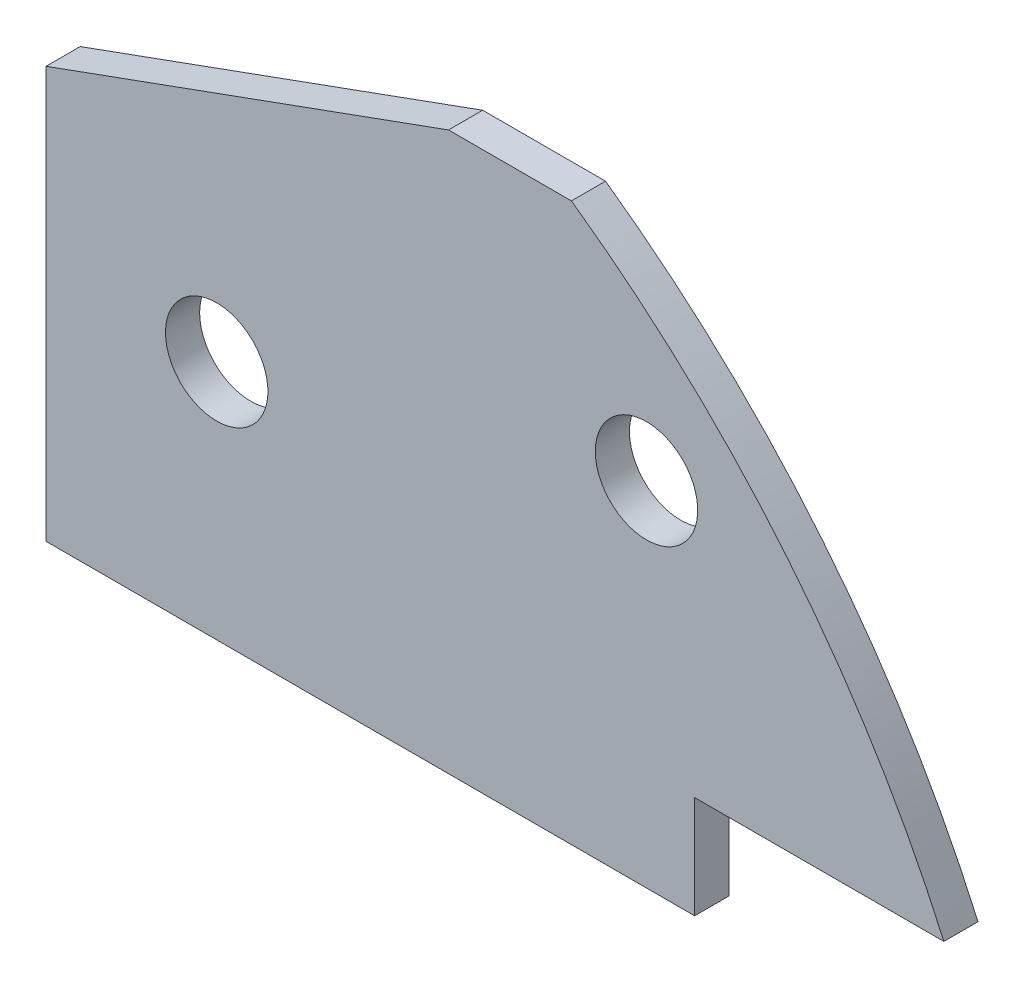
from build123d import *

# Parameters (mm, degrees)
BOSS_EXTRUDE1_DEPTH = 3
SKETCH2_R           = 1.5
CUT_EXTRUDE3_DEPTH  = 3
CUT_EXTRUDE4_START  = -10
CUT_EXTRUDE4_DEPTH  = 10
BOSS_EXTRUDE2_START = -3
BOSS_EXTRUDE2_DEPTH = 3
SKETCH5_W           = 0.56
SKETCH5_H           = 32.898596714
CUT_EXTRUDE5_DEPTH  = 3
SKETCH6_W           = 0.2
SKETCH6_H           = 32.898596714
CUT_EXTRUDE6_DEPTH  = 3
SKETCH7_R           = 2
CUT_EXTRUDE8_DEPTH  = 3
BOSS_EXTRUDE3_START = -3
BOSS_EXTRUDE3_DEPTH = 3
CUT_EXTRUDE9_START  = -3
CUT_EXTRUDE9_DEPTH  = 3
BOSS_EXTRUDE5_START = -3
BOSS_EXTRUDE5_DEPTH = 3
CUT_EXTRUDE10_START = -2
CUT_EXTRUDE10_DEPTH = 2
CUT_EXTRUDE11_START = -3
CUT_EXTRUDE11_DEPTH = 3
SKETCH13_R          = 1.5
CUT_EXTRUDE12_DEPTH = 1
CUT_EXTRUDE13_DEPTH = 10
SKETCH15_R          = 1.5
CUT_EXTRUDE14_DEPTH = 10


with BuildPart() as part:
    # Sketch1 → Boss-Extrude1 (new body)
    with BuildSketch(Plane.XY):
        with BuildLine():
            Line((-11, 25.5), (-22.790038711, 29.780264196))
            ThreePointArc((-22.790038711, 29.780264196), (0, -37.5), (22.790038711, 29.780264196))
            Line((22.790038711, 29.780264196), (11, 25.5))
            Line((11, 25.5), (-11, 25.5))
        make_face()
    extrude(amount=BOSS_EXTRUDE1_DEPTH)

    # Sketch2 → Cut-Extrude3 (cut)
    with BuildSketch(Plane.XY.offset(3)):
        with Locations((-25.400000001, 10.496905453)):
            Circle(SKETCH2_R)
        with Locations((-25.399981845, -10.493094547)):
            Circle(SKETCH2_R)
        with Locations(Location((25.399981845, -10.493094547, 0), (0, 0, 180))):
            Circle(SKETCH2_R)
        with Locations(Location((25.400000001, 10.496905453, 0), (0, 0, 180))):
            Circle(SKETCH2_R)
    extrude(amount=-CUT_EXTRUDE3_DEPTH, mode=Mode.SUBTRACT)

    # Sketch3 → Cut-Extrude4 (cut)
    with BuildSketch(Plane.XY.offset(3).offset(CUT_EXTRUDE4_START)):
        with BuildLine():
            Line((-30.76, 21.449298357), (-30.76, -21.449298357))
            ThreePointArc((-30.76, -21.449298357), (-37.5, 0), (-30.76, 21.449298357))
        make_face()
        with BuildLine():
            Line((30.76, 21.449298357), (30.76, -21.449298357))
            ThreePointArc((30.76, -21.449298357), (37.5, 0), (30.76, 21.449298357))
        make_face()
    extrude(amount=CUT_EXTRUDE4_DEPTH, mode=Mode.SUBTRACT)

    # Sketch4 → Boss-Extrude2 (add)
    with BuildSketch(Plane.XY.offset(3).offset(BOSS_EXTRUDE2_START)):
        with BuildLine():
            Line((-30.76, -21.449298357), (-30.76, -16.449298357))
            Line((-30.76, -16.449298357), (-33.699711921, -16.449298357))
            ThreePointArc((-33.699711921, -16.449298357), (-32.32667034, -19.006219634), (-30.76, -21.449298357))
        make_face()
        with BuildLine():
            Line((-33.699711921, 16.449298357), (-30.76, 16.449298357))
            Line((-30.76, 16.449298357), (-30.76, 21.449298357))
            ThreePointArc((-30.76, 21.449298357), (-32.32667034, 19.006219634), (-33.699711921, 16.449298357))
        make_face()
        with BuildLine():
            Line((30.76, 21.449298357), (30.76, 16.449298357))
            Line((30.76, 16.449298357), (33.699711921, 16.449298357))
            ThreePointArc((33.699711921, 16.449298357), (32.32667034, 19.006219634), (30.76, 21.449298357))
        make_face()
        with BuildLine():
            Line((30.76, -16.449298357), (30.76, -21.449298357))
            ThreePointArc((30.76, -21.449298357), (32.32667034, -19.006219634), (33.699711921, -16.449298357))
            Line((33.699711921, -16.449298357), (30.76, -16.449298357))
        make_face()
    extrude(amount=BOSS_EXTRUDE2_DEPTH)

    # Sketch5 → Cut-Extrude5 (cut)
    with BuildSketch(Plane.XY.offset(3)):
        with Locations((-30.48, 0)):
            Rectangle(SKETCH5_W, SKETCH5_H)
        with Locations((30.48, 0)):
            Rectangle(SKETCH5_W, SKETCH5_H)
    extrude(amount=-CUT_EXTRUDE5_DEPTH, mode=Mode.SUBTRACT)

    # Sketch6 → Cut-Extrude6 (cut)
    with BuildSketch(Plane.XY.offset(3)):
        with Locations((-30.1, 0)):
            Rectangle(SKETCH6_W, SKETCH6_H)
        with Locations((30.1, 0)):
            Rectangle(SKETCH6_W, SKETCH6_H)
    extrude(amount=-CUT_EXTRUDE6_DEPTH, mode=Mode.SUBTRACT)

    # Sketch7 → Cut-Extrude8 (cut)
    with BuildSketch(Plane.XY.offset(3)):
        with Locations((-19.15, -21.55)):
            Circle(SKETCH7_R)
        with Locations(Location((19.15, -21.55, 0), (0, 0, 180))):
            Circle(SKETCH7_R)
    extrude(amount=-CUT_EXTRUDE8_DEPTH, mode=Mode.SUBTRACT)

    # Sketch8 → Boss-Extrude3 (add)
    with BuildSketch(Plane.XY.offset(3).offset(BOSS_EXTRUDE3_START)):
        with BuildLine():
            Line((-33.699711921, 16.449298357), (-37.299711921, 16.449298357))
            ThreePointArc((-37.299711921, 16.449298357), (-32.744884003, 23.851322108), (-26.390038711, 29.780264196))
            Line((-26.390038711, 29.780264196), (-22.790038711, 29.780264196))
            ThreePointArc((-22.790038711, 29.780264196), (-29.020710607, 23.749702226), (-33.699711921, 16.449298357))
        make_face()
        with BuildLine():
            Line((33.699711921, 16.449298357), (37.299711921, 16.449298357))
            ThreePointArc((37.299711921, 16.449298357), (32.744884003, 23.851322108), (26.390038711, 29.780264196))
            Line((26.390038711, 29.780264196), (22.790038711, 29.780264196))
            ThreePointArc((22.790038711, 29.780264196), (29.020710607, 23.749702226), (33.699711921, 16.449298357))
        make_face()
    extrude(amount=BOSS_EXTRUDE3_DEPTH)

    # Sketch9 → Cut-Extrude9 (cut)
    with BuildSketch(Plane.XY.offset(3).offset(CUT_EXTRUDE9_START)):
        with BuildLine():
            Line((4.733920151, -37.2), (-4.733920151, -37.2))
            ThreePointArc((-4.733920151, -37.2), (0, -37.5), (4.733920151, -37.2))
        make_face()
    extrude(amount=CUT_EXTRUDE9_DEPTH, mode=Mode.SUBTRACT)

    # Sketch10 → Boss-Extrude5 (add)
    with BuildSketch(Plane.XY.offset(3).offset(BOSS_EXTRUDE5_START)):
        with BuildLine():
            ThreePointArc((-4.733920151, -37.2), (-21.838816892, -30.484685938), (-33.699711921, -16.449298357))
            Line((-33.699711921, -16.449298357), (-37.299711921, -16.449298357))
            ThreePointArc((-37.299711921, -16.449298357), (-23.43831182, -30.624902723), (-4.733920151, -37.2))
        make_face()
        with BuildLine():
            ThreePointArc((33.699711921, -16.449298357), (21.838816892, -30.484685938), (4.733920151, -37.2))
            ThreePointArc((4.733920151, -37.2), (23.43831182, -30.624902723), (37.299711921, -16.449298357))
            Line((37.299711921, -16.449298357), (33.699711921, -16.449298357))
        make_face()
        with BuildLine():
            Line((4.733920151, -37.2), (-4.733920151, -37.2))
            ThreePointArc((-4.733920151, -37.2), (0, -37.457659609), (4.733920151, -37.2))
        make_face()
    extrude(amount=BOSS_EXTRUDE5_DEPTH)

    # Sketch11 → Cut-Extrude10 (cut)
    with BuildSketch(Plane.XY.offset(3).offset(CUT_EXTRUDE10_START)):
        with BuildLine():
            Line((-30, 16.449298357), (-30, 13.449298357))
            Line((-30, 13.449298357), (30, 13.449298357))
            Line((30, 13.449298357), (30, 16.449298357))
            Line((30, 16.449298357), (37.299711921, 16.449298357))
            ThreePointArc((37.299711921, 16.449298357), (32.744884003, 23.851322108), (26.390038711, 29.780264196))
            Line((26.390038711, 29.780264196), (22.790038711, 29.780264196))
            Line((22.790038711, 29.780264196), (11, 25.5))
            Line((11, 25.5), (-11, 25.5))
            Line((-11, 25.5), (-22.790038711, 29.780264196))
            Line((-22.790038711, 29.780264196), (-26.390038711, 29.780264196))
            ThreePointArc((-26.390038711, 29.780264196), (-32.744884003, 23.851322108), (-37.299711921, 16.449298357))
            Line((-37.299711921, 16.449298357), (-30, 16.449298357))
        make_face()
    extrude(amount=CUT_EXTRUDE10_DEPTH, mode=Mode.SUBTRACT)

    # Sketch12 → Cut-Extrude11 (cut)
    with BuildSketch(Plane.XY.offset(3).offset(CUT_EXTRUDE11_START)):
        with BuildLine():
            Line((-30, 13.449298357), (-30, -16.449298357))
            Line((-30, -16.449298357), (-37.299711921, -16.449298357))
            ThreePointArc((-37.299711921, -16.449298357), (0, -37.457659609), (37.299711921, -16.449298357))
            Line((37.299711921, -16.449298357), (30, -16.449298357))
            Line((30, -16.449298357), (30, 13.449298357))
            Line((30, 13.449298357), (-30, 13.449298357))
        make_face()
    extrude(amount=CUT_EXTRUDE11_DEPTH, mode=Mode.SUBTRACT)

    # Sketch13 → Cut-Extrude12 (cut)
    with BuildSketch(Plane.XY.offset(1)):
        with Locations((-28.590038711, 23.780264196)):
            Circle(SKETCH13_R)
        with Locations(Location((28.590038711, 23.780264196, 0), (0, 0, 180))):
            Circle(SKETCH13_R)
    extrude(amount=-CUT_EXTRUDE12_DEPTH, mode=Mode.SUBTRACT)

    # Sketch14 → Cut-Extrude13 (cut)
    with BuildSketch(Plane(origin=(0, 0, 0), x_dir=(-1, 0, 0), z_dir=(0, 0, -1))):
        Polygon((-11, 25.5), (11, 25.5), (22.790038711, 29.780264196), (26.390038711, 29.780264196), (41.791678938, 29.780264196), (41.791678938, 13.449298357), (-11, 13.449298357), align=None)
    extrude(amount=-CUT_EXTRUDE13_DEPTH, mode=Mode.SUBTRACT)

    # Sketch15 → Cut-Extrude14 (cut)
    with BuildSketch(Plane(origin=(0, 0, 0), x_dir=(-1, 0, 0), z_dir=(0, 0, -1))):
        with Locations((-16, 20.5)):
            Circle(SKETCH15_R)
    extrude(amount=-CUT_EXTRUDE14_DEPTH, mode=Mode.SUBTRACT)


solid = part.part
